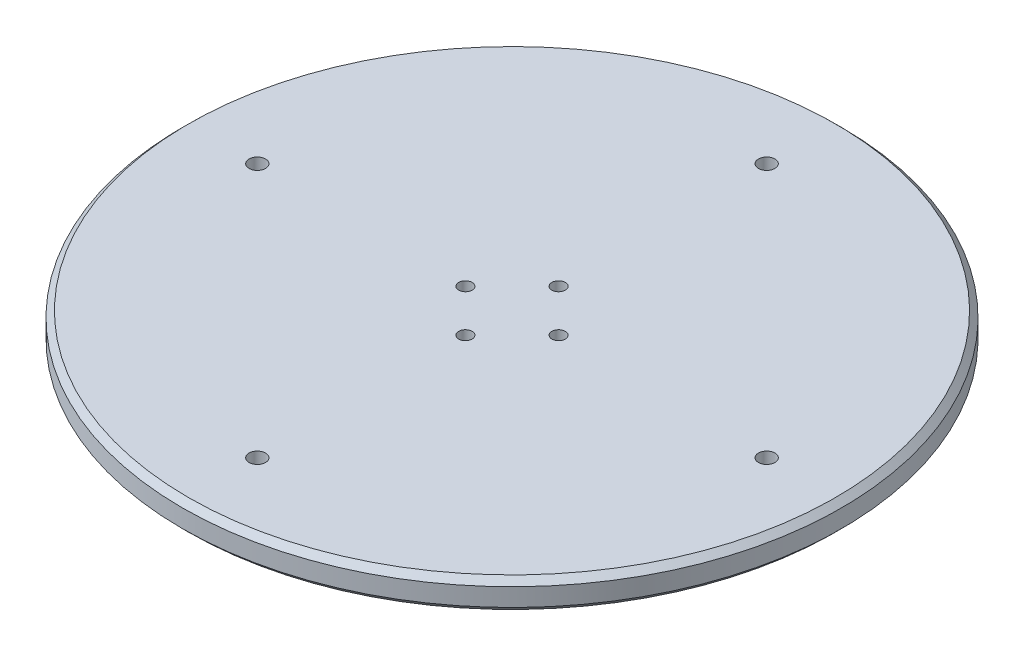
from build123d import *

# Parameters (mm, degrees)
SKETCH3_R                    = 110
BOSS_EXTRUDE_GB_BASEOD_DEPTH = 10
SKETCH4_R                    = 2.75
CUT_EXTRUDE1_DEPTH           = 156.884572681
CHAMFER1_SIZE                = 2
SKETCH7_R                    = 2.25
CUT_EXTRUDE2_DEPTH           = 156.884572681


with BuildPart() as part:
    # Sketch3 → Boss-Extrude_GB_BaseOD (new body)
    with BuildSketch(Plane(origin=(0, 0, 0), x_dir=(1, 0, 0), z_dir=(0, 1, 0))):
        with Locations(Location((0, 0, 0), (0, 0, 270))):
            Circle(SKETCH3_R)
    extrude(amount=BOSS_EXTRUDE_GB_BASEOD_DEPTH)

    # Sketch4 → Cut-Extrude1 (cut, through all)
    with BuildSketch(Plane(origin=(0, 10, 0), x_dir=(1, 0, 0), z_dir=(0, 1, 0))):
        with Locations(Location((-85, 0, 0), (0, 0, 270))):
            Circle(SKETCH4_R)
        with Locations(Location((0, 85, 0), (0, 0, 270))):
            Circle(SKETCH4_R)
        with Locations(Location((85, 0, 0), (0, 0, 270))):
            Circle(SKETCH4_R)
        with Locations(Location((0, -85, 0), (0, 0, 270))):
            Circle(SKETCH4_R)
    extrude(amount=-CUT_EXTRUDE1_DEPTH, mode=Mode.SUBTRACT)

    # Chamfer1
    chamfer1_edges = [part.edges().sort_by_distance(p)[0] for p in [
        (0, 0, -110),
        (0, 10, -110),
    ]]
    chamfer(chamfer1_edges, length=CHAMFER1_SIZE)

    # Sketch7 → Cut-Extrude2 (cut, through all)
    with BuildSketch(Plane(origin=(0, 10, 0), x_dir=(1, 0, 0), z_dir=(0, 1, 0))):
        with Locations(Location((14.849242405, 0.707106781, 0), (0, 0, 270))):
            Circle(SKETCH7_R)
        with Locations(Location((0.707106781, 14.849242405, 0), (0, 0, 90))):
            Circle(SKETCH7_R)
        with Locations(Location((-14.849242405, -0.707106781, 0), (0, 0, 270))):
            Circle(SKETCH7_R)
        with Locations(Location((-0.707106781, -14.849242405, 0), (0, 0, 90))):
            Circle(SKETCH7_R)
    extrude(amount=-CUT_EXTRUDE2_DEPTH, mode=Mode.SUBTRACT)


solid = part.part
